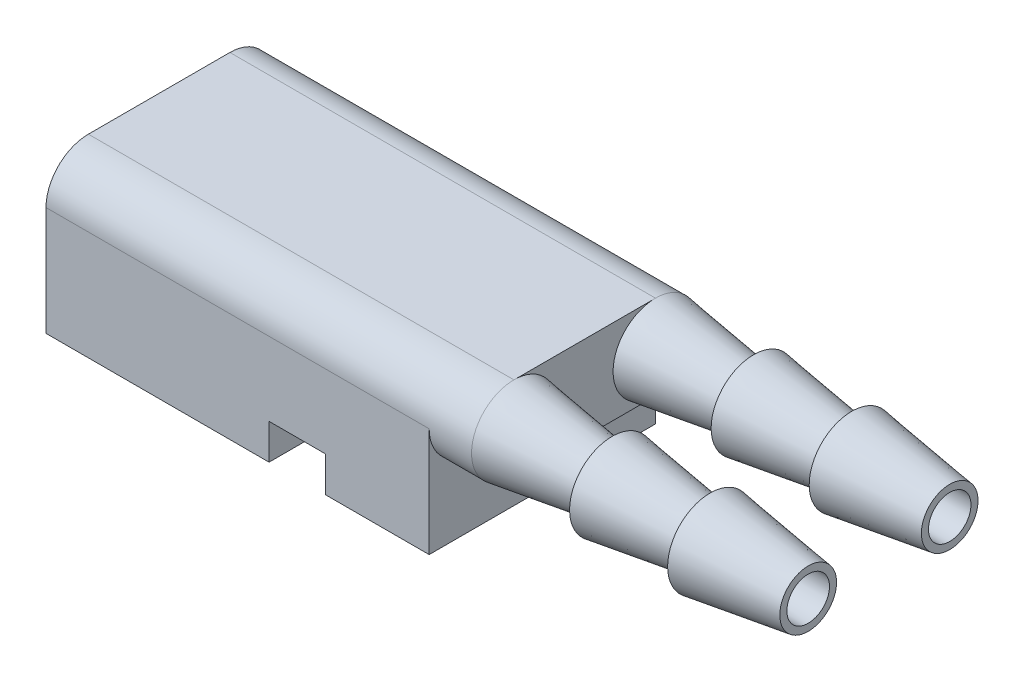
from build123d import *

# Parameters (mm, degrees)
BOSS_EXTRUDE1_START             = -30.0707
SKETCH3_R                       = 1.5016
SKETCH3_R_2                     = 1.5
BOSS_EXTRUDE1_DEPTH             = 30.0707
CUT_EXTRUDE2_DEPTH              = 23
BOSS_EXTRUDE3_DEPTH             = 6.5
SKETCH7_R                       = 5
CUT_EXTRUDE3_DEPTH              = 3
SKETCH8_R                       = 5
BOSS_EXTRUDE6_DEPTH             = 4.7
BOSS_EXTRUDE6_DIRECTION_2_REACH = 35.307
SKETCH10_W                      = 4
SKETCH10_H                      = 15.987461918
CUT_EXTRUDE5_DEPTH              = 2.5


with BuildPart() as part:
    # Sketch1 → Revolve1 (revolve)
    with BuildSketch(Plane(origin=(0, 0, 0), x_dir=(1, 0, 0), z_dir=(0, 1, 0)), mode=Mode.PRIVATE) as revolve1_sk:
        with BuildLine():
            Line((6.928433616, 2.347926937), (6.928433616, 3))
            Line((6.928433616, 3), (13.514078553, 2.050994067))
            ThreePointArc((13.514078553, 2.050994067), (13.753289477, 2.121170896), (13.856867233, 2.347926937))
            Line((13.856867233, 2.347926937), (13.856867233, 3))
            Line((13.856867233, 3), (20.785300849, 2.001597464))
            Line((20.785300849, 2.001597464), (20.785300849, 1.5016))
            Line((20.785300849, 1.5016), (0, 1.5016))
            Line((0, 1.5016), (0, 3))
            Line((0, 3), (6.585644936, 2.050994067))
            ThreePointArc((6.585644936, 2.050994067), (6.82485586, 2.121170896), (6.928433616, 2.347926937))
        make_face()
    revolve(revolve1_sk.sketch.rotate(Axis((0, 0, 0), (1, 0, 0)), 180), axis=Axis((0, 0, 0), (1, 0, 0)))



with BuildPart() as body_2:
    # Sketch2 → Revolve2 (revolve)
    with BuildSketch(Plane(origin=(0, 0, 0), x_dir=(1, 0, 0), z_dir=(0, 1, 0)), mode=Mode.PRIVATE) as revolve2_sk:
        with BuildLine():
            Line((0, -7), (6.585644936, -7.949005933))
            ThreePointArc((6.585644936, -7.949005933), (6.82485586, -7.878829104), (6.928433616, -7.652073063))
            Line((6.928433616, -7.652073063), (6.928433616, -6.998402536))
            Line((6.928433616, -6.998402536), (13.514078553, -7.947408468))
            ThreePointArc((13.514078553, -7.947408468), (13.753289477, -7.87723164), (13.856867233, -7.650475599))
            Line((13.856867233, -7.650475599), (13.856867233, -6.996805072))
            Line((13.856867233, -6.996805072), (20.785300849, -7.995207608))
            Line((20.785300849, -7.995207608), (20.785300849, -8.495205108))
            Line((20.785300849, -8.495205108), (0, -8.5))
            Line((0, -8.5), (0, -7))
        make_face()
    revolve(revolve2_sk.sketch.rotate(Axis((0, 0, 10), (1, 0, 0)), 180), axis=Axis((0, 0, 10), (1, 0, 0)))


with BuildPart() as part_1:
    add(part.part)

    add(body_2.part)  # Boss-Extrude1 merges body 2
    # Sketch3 → Boss-Extrude1 (add)
    with BuildSketch(Plane(origin=(0, 0, 0), x_dir=(0, 0, -1), z_dir=(1, 0, 0)).offset(BOSS_EXTRUDE1_START)):
        with BuildLine():
            Line((0, -2.993730959), (-10, -2.993730959))
            ThreePointArc((-10, -2.993730959), (-12.993730959, 0), (-10, 2.993730959))
            Line((-10, 2.993730959), (0, 2.993730959))
            ThreePointArc((0, 2.993730959), (2.993730959, 0), (0, -2.993730959))
        make_face()
        with Locations(Location((0, 0, 0), (0, 0, 180))):
            Circle(SKETCH3_R, mode=Mode.SUBTRACT)
        with Locations((-10, 0)):
            Circle(SKETCH3_R_2, mode=Mode.SUBTRACT)
    extrude(amount=BOSS_EXTRUDE1_DEPTH)

    # Sketch4 → Cut-Extrude2 (cut)
    with BuildSketch(Plane(origin=(-23.5707, 0, 0), x_dir=(0, 0, -1), z_dir=(1, 0, 0))):
        with BuildLine():
            Line((-10, 1.512580603), (0, 1.512580603))
            ThreePointArc((0, 1.512580603), (1.512580603, 0), (0, -1.512580603))
            Line((0, -1.512580603), (-10, -1.512580603))
            ThreePointArc((-10, -1.512580603), (-11.512580603, 0), (-10, 1.512580603))
        make_face()
    extrude(amount=CUT_EXTRUDE2_DEPTH, mode=Mode.SUBTRACT)

    # Sketch5 → Boss-Extrude3 (add)
    with BuildSketch(Plane(origin=(-30.0707, 0, 0), x_dir=(0, 0, -1), z_dir=(1, 0, 0))):
        with BuildLine():
            Line((-10, 2.991500791), (0, 2.991500791))
            ThreePointArc((0, 2.991500791), (2.991500791, 0), (0, -2.991500791))
            Line((0, -2.991500791), (-10, -2.991500791))
            ThreePointArc((-10, -2.991500791), (-12.991500791, 0), (-10, 2.991500791))
        make_face()
    extrude(amount=BOSS_EXTRUDE3_DEPTH)

    # Sketch7 → Cut-Extrude3 (cut)
    with BuildSketch(Plane(origin=(0, -3, 0), x_dir=(1, 0, 0), z_dir=(0, 1, 0))):
        with Locations(Location((-18.0707, -5, 0), (0, 0, 90))):
            Circle(SKETCH7_R)
    extrude(amount=CUT_EXTRUDE3_DEPTH, mode=Mode.SUBTRACT)

    # Sketch8 → Boss-Extrude6 (add)
    with BuildSketch(Plane(origin=(0, -3, 0), x_dir=(1, 0, 0), z_dir=(0, 1, 0))):
        Polygon((-30.0707, -5), (-30.0707, -12.993730959), (-3, -12.993730959), (-3, 2.993730959), (-30.0707, 2.993730959), align=None)
        with Locations(Location((-18.0707, -5, 0), (0, 0, 270))):
            Circle(SKETCH8_R, mode=Mode.SUBTRACT)
    extrude(amount=-BOSS_EXTRUDE6_DEPTH)

    # Sketch8 → Boss-Extrude6 direction 2 (add, up to next)
    with BuildSketch(Plane(origin=(0, -3, 0), x_dir=(1, 0, 0), z_dir=(0, 1, 0)), mode=Mode.PRIVATE) as boss_extrude6_direction_2_sk1:
        Polygon((-30.0707, -5), (-30.0707, -12.993730959), (-3, -12.993730959), (-3, 2.993730959), (-30.0707, 2.993730959), align=None)
        with Locations(Location((-18.0707, -5, 0), (0, 0, 270))):
            Circle(SKETCH8_R, mode=Mode.SUBTRACT)
    boss_extrude6_direction_2_tool1 = extrude(boss_extrude6_direction_2_sk1.sketch, amount=BOSS_EXTRUDE6_DIRECTION_2_REACH, mode=Mode.PRIVATE) - part_1.part
    add(boss_extrude6_direction_2_tool1.solids().sort_by_distance((-29.756308, -3, 8.996865))[0])

    # Sketch10 → Cut-Extrude5 (cut)
    with BuildSketch(Plane(origin=(0, -7.7, 0), x_dir=(1, 0, 0), z_dir=(0, 1, 0))):
        with Locations((-12.3107, -5)):
            Rectangle(SKETCH10_W, SKETCH10_H)
    extrude(amount=CUT_EXTRUDE5_DEPTH, mode=Mode.SUBTRACT)


solid = part_1.part
